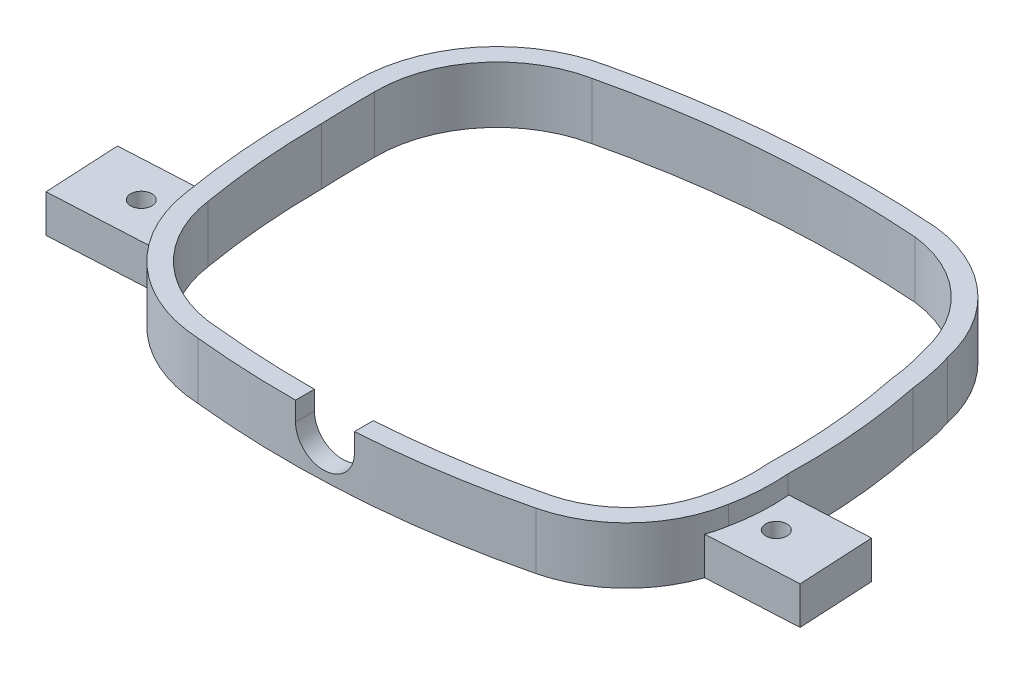
from build123d import *

# Parameters (mm, degrees)
BOSS_EXTRUDE1_DEPTH = 9.525
SKETCH3_R           = 1.778
BOSS_EXTRUDE2_DEPTH = 6.35
CUT_EXTRUDE1_DEPTH  = 62.992


with BuildPart() as part:
    # Sketch2 → Boss-Extrude1 (new body)
    with BuildSketch(Plane(origin=(0, 0, 0), x_dir=(1, 0, 0), z_dir=(0, 1, 0))):
        with BuildLine():
            ThreePointArc((-27.371275132, 38.745818095), (-40.973617499, 30.433742494), (-46.191603644, 15.370975839))
            ThreePointArc((-46.191603644, 15.370975839), (-46.156170212, 10.799100226), (-46.01239655, 6.229348451))
            ThreePointArc((-46.01239655, 6.229348451), (-45.554867394, -4.424369785), (-44.211253726, -15.00292108))
            ThreePointArc((-44.211253726, -15.00292108), (-36.72609395, -29.152486681), (-21.949825784, -35.308761743))
            ThreePointArc((-21.949825784, -35.308761743), (4.789142288, -35.769006094), (31.212812312, -31.649066671))
            ThreePointArc((31.212812312, -31.649066671), (41.496738573, -25.613366213), (46.788564963, -14.927609673))
            ThreePointArc((46.788564963, -14.927609673), (47.409631974, -10.227797309), (47.362149343, -5.487364219))
            ThreePointArc((47.362149343, -5.487364219), (47.025821725, 6.063769752), (45.378811544, 17.501827706))
            ThreePointArc((45.378811544, 17.501827706), (44.784036993, 21.245111147), (43.826445822, 24.912391724))
            ThreePointArc((43.826445822, 24.912391724), (36.726457071, 37.077263766), (23.883695238, 42.861502743))
            ThreePointArc((23.883695238, 42.861502743), (-1.899636761, 42.744509754), (-27.371275132, 38.745818095))
        make_face()
        with BuildLine():
            ThreePointArc((-26.686729853, 35.645166459), (-38.494719431, 28.449859817), (-43.016527849, 15.382560778))
            ThreePointArc((-43.016527849, 15.382560778), (-42.981363707, 10.840148441), (-42.837461763, 6.299879882))
            ThreePointArc((-42.837461763, 6.299879882), (-42.392238342, -4.14410464), (-41.073809227, -14.514098915))
            ThreePointArc((-41.073809227, -14.514098915), (-34.571127727, -26.820697593), (-21.709378759, -32.141660966))
            ThreePointArc((-21.709378759, -32.141660966), (4.527721192, -32.604481914), (30.456209617, -28.565533412))
            ThreePointArc((30.456209617, -28.565533412), (39.190718322, -23.430787451), (43.667641206, -14.341539963))
            ThreePointArc((43.667641206, -14.341539963), (44.243978017, -9.976676032), (44.183339256, -5.574344354))
            ThreePointArc((44.183339256, -5.574344354), (43.863792824, 5.776703787), (42.237767725, 17.015228877))
            ThreePointArc((42.237767725, 17.015228877), (41.676987361, 20.591755151), (40.755667539, 24.092781371))
            ThreePointArc((40.755667539, 24.092781371), (34.67633853, 34.650507535), (23.588863748, 39.699440682))
            ThreePointArc((23.588863748, 39.699440682), (-1.702378082, 39.575120085), (-26.686729853, 35.645166459))
        make_face(mode=Mode.SUBTRACT)
    extrude(amount=BOSS_EXTRUDE1_DEPTH)

    # Sketch3 → Boss-Extrude2 (add)
    # profile 1 of 2: a face of its own
    with BuildSketch(Plane(origin=(0, 0, 0), x_dir=(1, 0, 0), z_dir=(0, 1, 0))):
        with BuildLine():
            ThreePointArc((43.667641206, -14.341539963), (43.210882804, -16.338608318), (42.526004307, -18.269372853))
            Line((42.526004307, -18.269372853), (61.233464192, -17.288956425))
            Line((61.233464192, -17.288956425), (60.568797548, -4.606361333))
            Line((60.568797548, -4.606361333), (44.173733451, -5.465590234))
            ThreePointArc((44.173733451, -5.465590234), (44.247134499, -9.922178586), (43.667641206, -14.341539963))
        make_face()
        with Locations(Location((51.389184551, -11.446158862, 0), (0, 0, 270))):
            Circle(SKETCH3_R, mode=Mode.SUBTRACT)
    # profile 2 of 2: a face of its own
    with BuildSketch(Plane(origin=(0, 0, 0), x_dir=(1, 0, 0), z_dir=(0, 1, 0))):
        with BuildLine():
            Line((-59.91585582, -10.920694454), (-59.251189176, -23.603289546))
            Line((-59.251189176, -23.603289546), (-38.172742485, -22.498614964))
            ThreePointArc((-38.172742485, -22.498614964), (-40.010730071, -18.741588452), (-41.048292167, -14.689809648))
            ThreePointArc((-41.048292167, -14.689809648), (-41.491708705, -12.342684149), (-41.760500894, -9.96921262))
            Line((-41.760500894, -9.96921262), (-59.91585582, -10.920694454))
        make_face()
        with Locations(Location((-50.07157618, -16.763492017, 0), (0, 0, 270))):
            Circle(SKETCH3_R, mode=Mode.SUBTRACT)
    extrude(amount=BOSS_EXTRUDE2_DEPTH)

    # Sketch4 → Cut-Extrude1 (cut)
    with BuildSketch(Plane.XY):
        with BuildLine():
            Line((-4.7625, 9.525), (4.7625, 9.525))
            Line((4.7625, 9.525), (4.7625, 6.35))
            ThreePointArc((4.7625, 6.35), (0, 1.5875), (-4.7625, 6.35))
            Line((-4.7625, 6.35), (-4.7625, 9.525))
        make_face()
    extrude(amount=CUT_EXTRUDE1_DEPTH, mode=Mode.SUBTRACT)


solid = part.part
